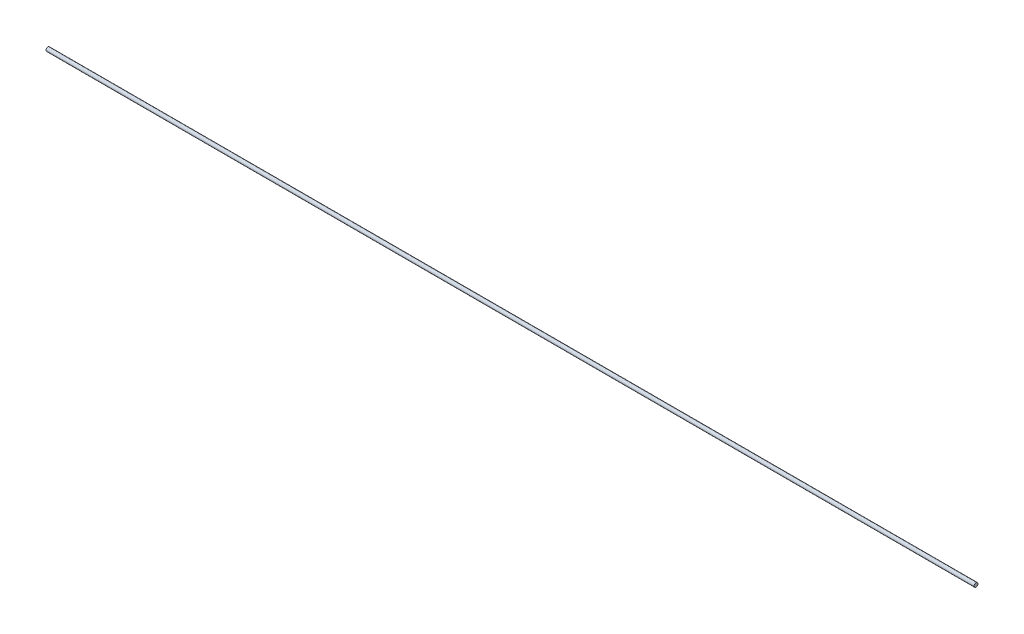
from build123d import *

# Parameters (mm, degrees)
SKETCH1_R           = 3.175
BOSS_EXTRUDE1_DEPTH = 1524


with BuildPart() as part:
    # Sketch1 → Boss-Extrude1 (new body)
    with BuildSketch(Plane(origin=(0, 0, 0), x_dir=(0, 0, -1), z_dir=(1, 0, 0))):
        Circle(SKETCH1_R)
    extrude(amount=BOSS_EXTRUDE1_DEPTH)


solid = part.part
